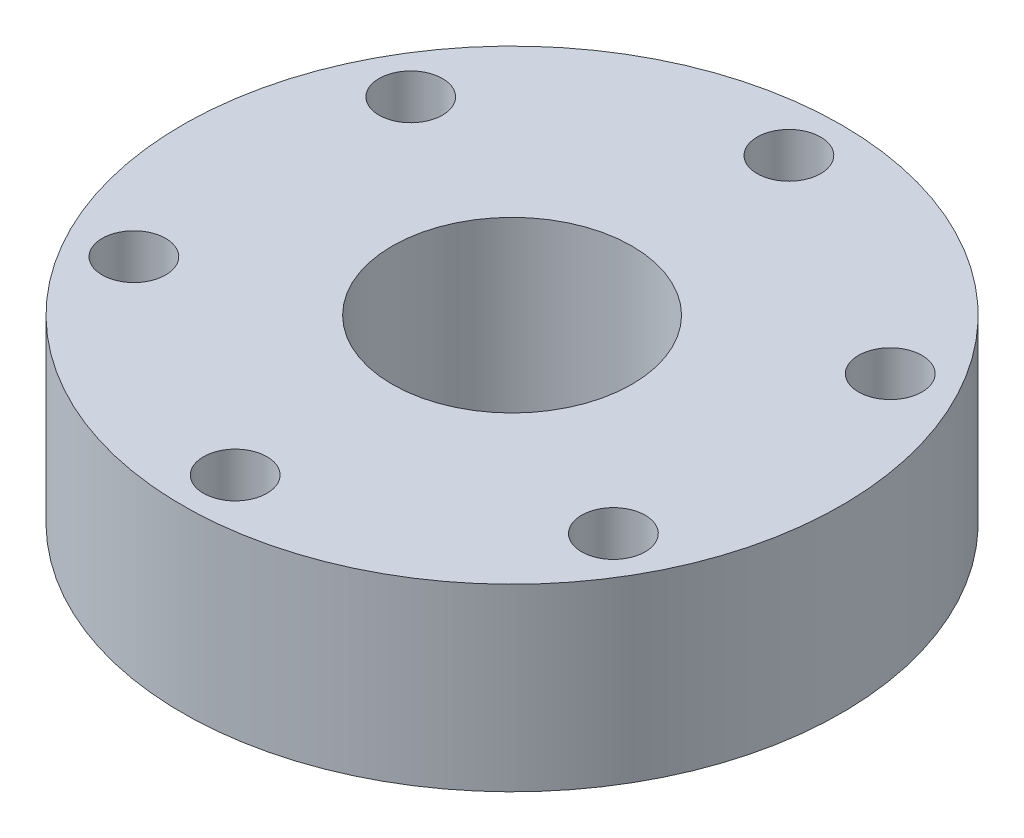
from build123d import *

# Parameters (mm, degrees)
SKETCH1_R          = 34.925
EXTRUDE1_DEPTH     = 19.05
SKETCH2_R          = 12.7
CUT_EXTRUDE1_DEPTH = 53.937829102
SKETCH3_R          = 3.3655
CUT_EXTRUDE2_DEPTH = 53.937829102
CIRPATTERN1_COUNT  = 6


with BuildPart() as part:
    # Sketch1 → Extrude1 (new body)
    with BuildSketch(Plane(origin=(0, 0, 0), x_dir=(1, 0, 0), z_dir=(0, 1, 0))):
        Circle(SKETCH1_R)
    extrude(amount=EXTRUDE1_DEPTH)

    # Sketch2 → Cut-Extrude1 (cut, through all)
    with BuildSketch(Plane(origin=(0, 0, 0), x_dir=(1, 0, 0), z_dir=(0, 1, 0))):
        Circle(SKETCH2_R)
    extrude(amount=CUT_EXTRUDE1_DEPTH, mode=Mode.SUBTRACT)

    # Sketch3 → Cut-Extrude2 (cut, through all)
    with BuildSketch(Plane(origin=(0, 0, 0), x_dir=(1, 0, 0), z_dir=(0, 1, 0))):
        with Locations((0, 29.337)):
            Circle(SKETCH3_R)
    cut_extrude2 = extrude(amount=CUT_EXTRUDE2_DEPTH, mode=Mode.SUBTRACT)

    # CirPattern1: Cut-Extrude2 ×6 about axis
    cirpattern1_axis = Axis((0, 35.858162691, 0), (0, -1, 0))
    for i in range(1, CIRPATTERN1_COUNT):
        add(cut_extrude2.rotate(cirpattern1_axis, i * 360 / CIRPATTERN1_COUNT), mode=Mode.SUBTRACT)


solid = part.part
